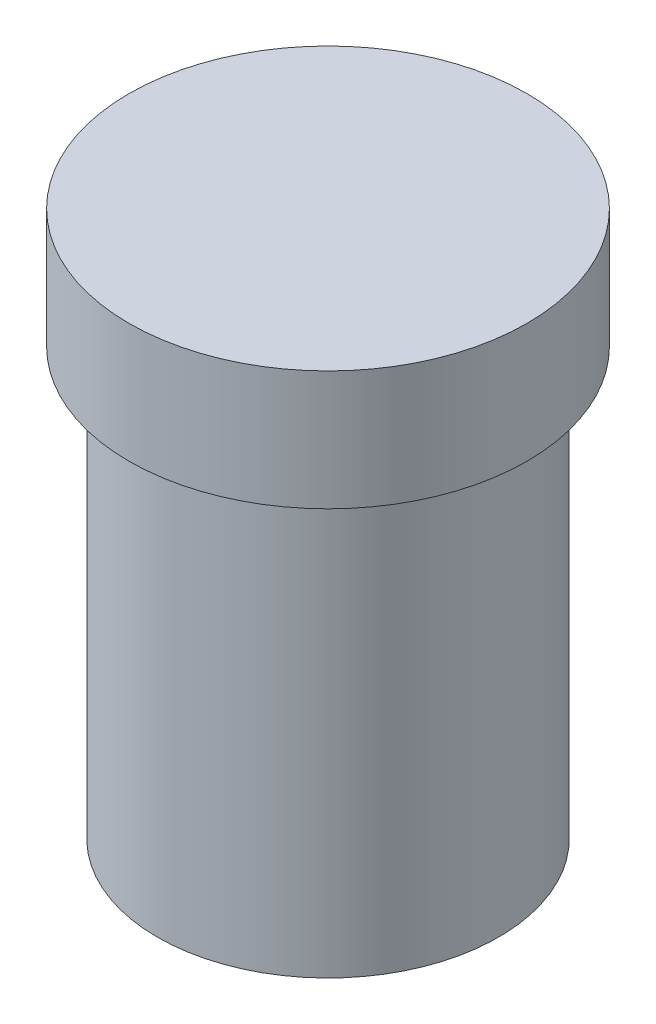
from build123d import *

# Parameters (mm, degrees)
SKETCH1_R           = 6
BOSS_EXTRUDE1_DEPTH = 15
SKETCH2_R           = 7
BOSS_EXTRUDE2_DEPTH = 4.2


with BuildPart() as part:
    # Sketch1 → Boss-Extrude1 (new body)
    with BuildSketch(Plane(origin=(0, 0, 0), x_dir=(1, 0, 0), z_dir=(0, 1, 0))):
        with Locations(Location((0, 0, 0), (0, 0, 270))):
            Circle(SKETCH1_R)
    extrude(amount=BOSS_EXTRUDE1_DEPTH)

    # Sketch2 → Boss-Extrude2 (add)
    with BuildSketch(Plane(origin=(0, 15, 0), x_dir=(1, 0, 0), z_dir=(0, 1, 0))):
        with Locations(Location((0, 0, 0), (0, 0, 270))):
            Circle(SKETCH2_R)
    extrude(amount=BOSS_EXTRUDE2_DEPTH)


solid = part.part
